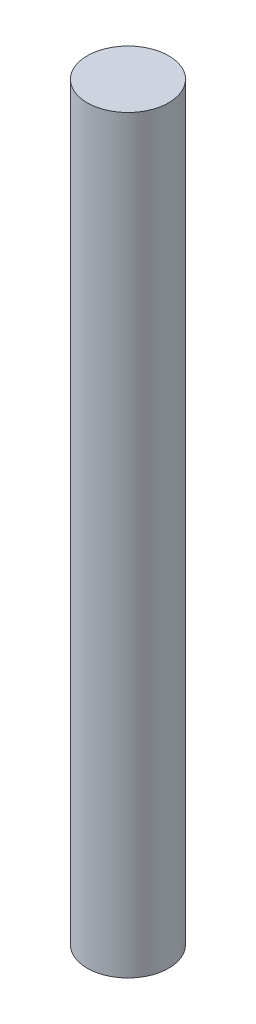
from build123d import *

# Parameters (mm, degrees)
SKETCH1_R           = 2.5
BOSS_EXTRUDE1_DEPTH = 46


with BuildPart() as part:
    # Sketch1 → Boss-Extrude1 (new body)
    with BuildSketch(Plane(origin=(0, 0, 0), x_dir=(1, 0, 0), z_dir=(0, 1, 0))):
        with Locations(Location((0, 0, 0), (0, 0, 270))):
            Circle(SKETCH1_R)
    extrude(amount=BOSS_EXTRUDE1_DEPTH)


solid = part.part
